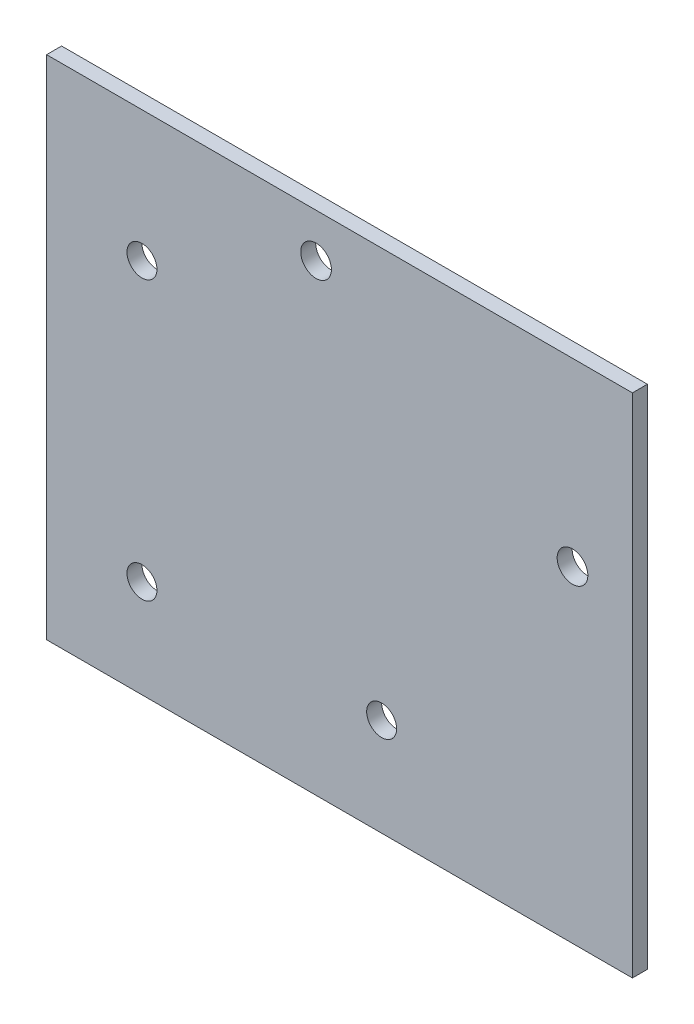
from build123d import *

# Parameters (mm, degrees)
SKETCH1_W           = 124.170843137
SKETCH1_H           = 107.411334798
SKETCH1_R           = 3.175
SKETCH1_R_2         = 3.2512
BOSS_EXTRUDE1_DEPTH = 3.175


with BuildPart() as part:
    # Sketch1 → Boss-Extrude1 (new body)
    with BuildSketch(Plane.XY):
        with Locations((67.272633407, 150.899612868)):
            Rectangle(SKETCH1_W, SKETCH1_H)
        with Locations((25.4, 117.928571429)):
            Circle(SKETCH1_R, mode=Mode.SUBTRACT)
        with Locations((25.4, 176.892857143)):
            Circle(SKETCH1_R, mode=Mode.SUBTRACT)
        with Locations((76.2, 117.928571429)):
            Circle(SKETCH1_R, mode=Mode.SUBTRACT)
        with Locations((116.658054975, 166.37)):
            Circle(SKETCH1_R_2, mode=Mode.SUBTRACT)
        with Locations((62.302054975, 195.326)):
            Circle(SKETCH1_R_2, mode=Mode.SUBTRACT)
    extrude(amount=BOSS_EXTRUDE1_DEPTH)


solid = part.part
